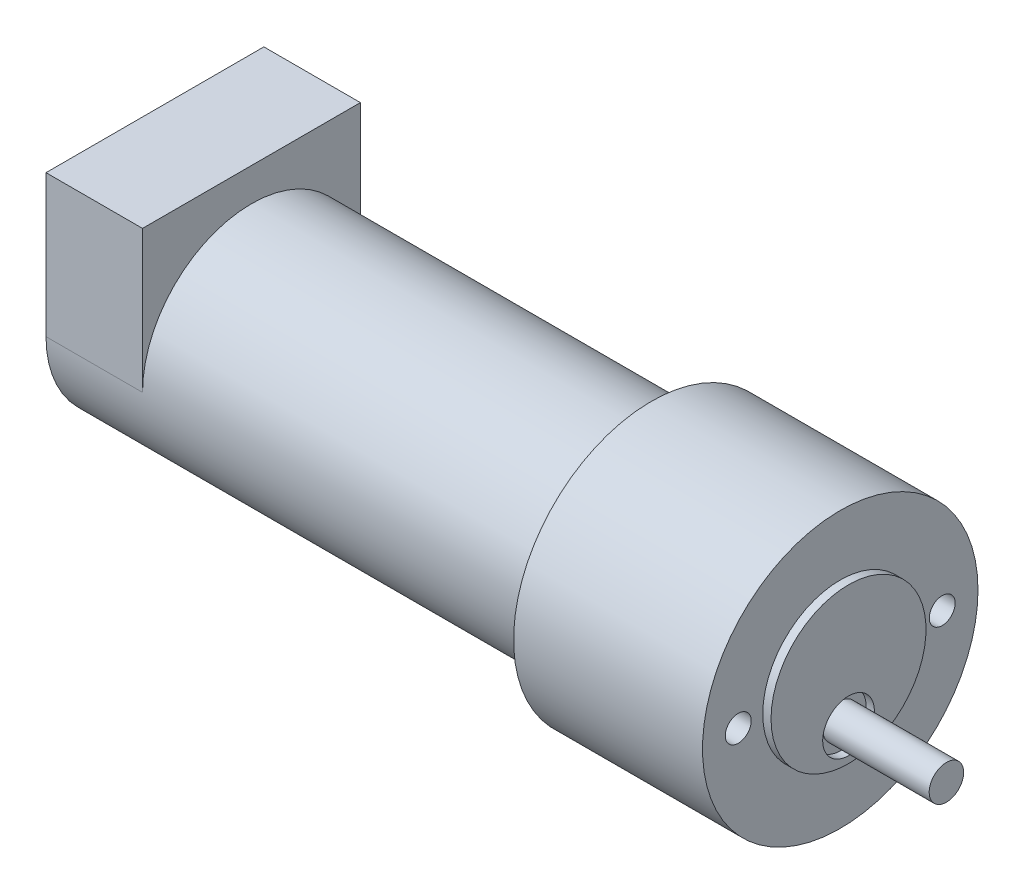
from build123d import *

# Parameters (mm, degrees)
SKETCH1_R           = 20.066
BOSS_EXTRUDE1_DEPTH = 91.44
BOSS_EXTRUDE2_DEPTH = 17.78
SKETCH3_R           = 25.3746
BOSS_EXTRUDE3_DEPTH = 34.798
SKETCH5_R           = 14.2748
SKETCH5_R_2         = 4.7625
BOSS_EXTRUDE5_DEPTH = 1.524
SKETCH6_R           = 3.175
BOSS_EXTRUDE6_DEPTH = 19.558
SKETCH7_R           = 2.3876
CUT_EXTRUDE1_DEPTH  = 12.7


with BuildPart() as part:
    # Sketch1 → Boss-Extrude1 (new body)
    with BuildSketch(Plane(origin=(0, 0, 0), x_dir=(0, 0, -1), z_dir=(1, 0, 0))):
        Circle(SKETCH1_R)
    extrude(amount=BOSS_EXTRUDE1_DEPTH)

    # Sketch2 → Boss-Extrude2 (add)
    with BuildSketch(Plane.ZY):
        with BuildLine():
            Line((-20.066, 26.162), (20.066, 26.162))
            Line((20.066, 26.162), (20.066, 0))
            ThreePointArc((20.066, 0), (0, -20.066), (-20.066, 0))
            Line((-20.066, 0), (-20.066, 26.162))
        make_face()
    extrude(amount=-BOSS_EXTRUDE2_DEPTH)

    # Sketch3 → Boss-Extrude3 (add)
    with BuildSketch(Plane(origin=(91.44, 0, 0), x_dir=(0, 0, -1), z_dir=(1, 0, 0))):
        Circle(SKETCH3_R)
    extrude(amount=BOSS_EXTRUDE3_DEPTH)

    # Sketch5 → Boss-Extrude5 (add)
    with BuildSketch(Plane(origin=(126.238, 0, 0), x_dir=(0, 0, -1), z_dir=(1, 0, 0))):
        with Locations(Location((0, 0, 0), (0, 0, 180))):
            Circle(SKETCH5_R)
        with Locations(Location((0, -8.2296, 0), (0, 0, 180))):
            Circle(SKETCH5_R_2, mode=Mode.SUBTRACT)
    extrude(amount=BOSS_EXTRUDE5_DEPTH)

    # Sketch6 → Boss-Extrude6 (add)
    with BuildSketch(Plane(origin=(126.238, 0, 0), x_dir=(0, 0, -1), z_dir=(1, 0, 0))):
        with Locations((0, -8.2296)):
            Circle(SKETCH6_R)
    extrude(amount=BOSS_EXTRUDE6_DEPTH)

    # Sketch7 → Cut-Extrude1 (cut)
    with BuildSketch(Plane(origin=(126.238, 0, 0), x_dir=(0, 0, -1), z_dir=(1, 0, 0))):
        with Locations((18.7833, 0)):
            Circle(SKETCH7_R)
        with Locations(Location((-18.7833, 0, 0), (0, 0, 180))):
            Circle(SKETCH7_R)
    extrude(amount=-CUT_EXTRUDE1_DEPTH, mode=Mode.SUBTRACT)


solid = part.part
